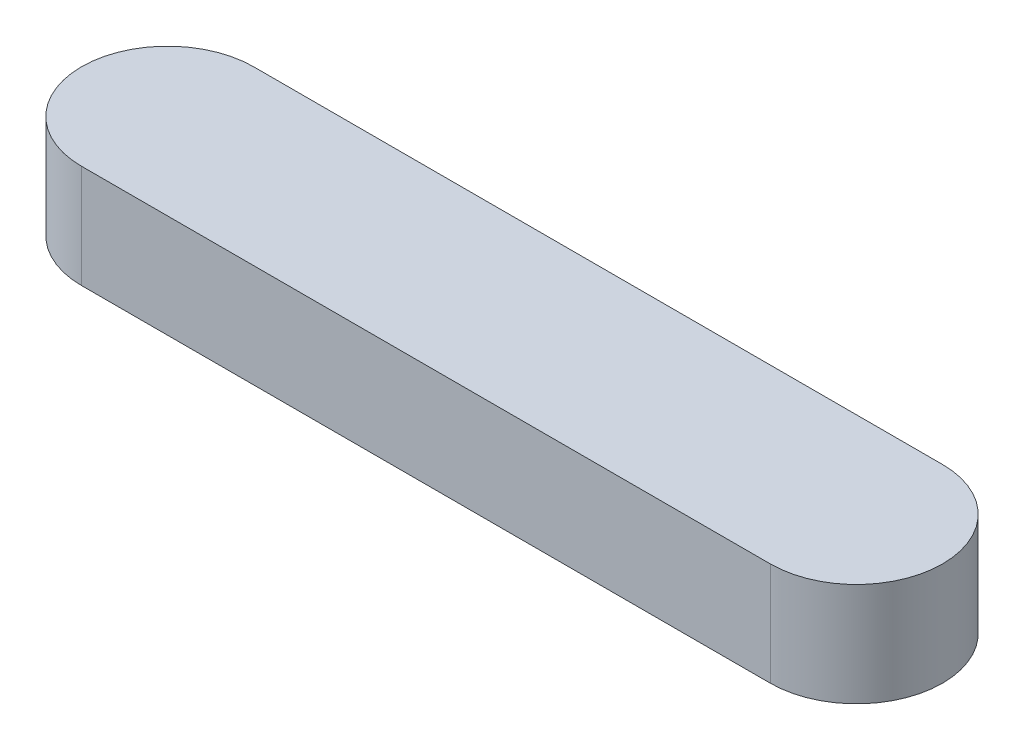
from build123d import *

# Parameters (mm, degrees)
BOSS_EXTRU_1_DEPTH = 12


with BuildPart() as part:
    # Esquisse1 → Boss.-Extru.1 (new body)
    with BuildSketch(Plane(origin=(0, 0, 0), x_dir=(1, 0, 0), z_dir=(0, 1, 0))):
        with BuildLine():
            Line((40, -10), (-40, -10))
            ThreePointArc((-40, -10), (-50, 0), (-40, 10))
            Line((-40, 10), (40, 10))
            ThreePointArc((40, 10), (50, 0), (40, -10))
        make_face()
    extrude(amount=BOSS_EXTRU_1_DEPTH)


solid = part.part
